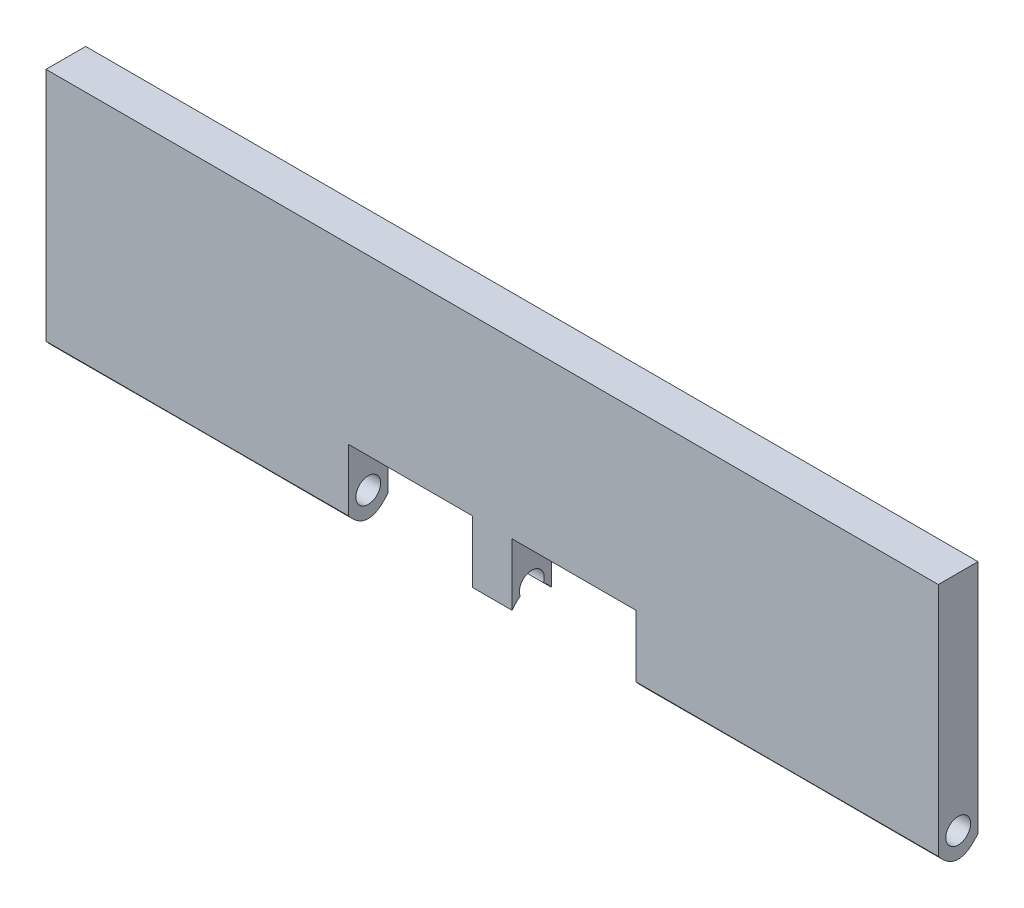
from build123d import *

# Parameters (mm, degrees)
BOSS_EXTRU_1_DEPTH      = 8
ENL_V_MAT_EXTRU_1_REACH = 183.904
ESQUISSE2_R             = 2.5
BOSS_EXTRU_2_DEPTH      = 2.5
BOSS_EXTRU_2_DEPTH_BACK = 2.5
ESQUISSE4_R             = 2.5
ENL_V_MAT_EXTRU_2_DEPTH = 8


with BuildPart() as part:
    # Esquisse1 → Boss.-Extru.1 (new body)
    with BuildSketch(Plane.XY):
        Polygon((-29, -25), (-29, -10), (-4, -10), (-4, -25), (4, -25), (4, -10), (29, -10), (29, -25), (90, -25), (90, 25), (-90, 25), (-90, -25), align=None)
    extrude(amount=BOSS_EXTRU_1_DEPTH)

    # Enlèv. mat.-Extru.1: up to this face of the body (flat: up to its plane)
    enl_v_mat_extru_1_end = Plane(part.part.faces().sort_by_distance((90, 0, 4))[0])
    # Esquisse2 → Enlèv. mat.-Extru.1 (cut, up to the picked face)
    with BuildSketch(Plane.ZY.offset(90), mode=Mode.PRIVATE) as enl_v_mat_extru_1_sk1:
        with BuildLine():
            add(Edge.make_bspline(
                [(4, -25), (6, -25), (8, -22.5)],
                knots=[0.5, 0.5, 0.5, 1, 1, 1], degree=2))
            Line((4, -25), (8, -25))
            Line((8, -25), (8, -22.5))
        make_face()
    enl_v_mat_extru_1_tool1 = split(extrude(enl_v_mat_extru_1_sk1.sketch, amount=-ENL_V_MAT_EXTRU_1_REACH, mode=Mode.PRIVATE), bisect_by=enl_v_mat_extru_1_end, keep=Keep.BOTH, mode=Mode.PRIVATE)
    # Esquisse2 → Enlèv. mat.-Extru.1 (cut, up to the picked face)
    with BuildSketch(Plane.ZY.offset(90), mode=Mode.PRIVATE) as enl_v_mat_extru_1_sk2:
        with BuildLine():
            add(Edge.make_bspline(
                [(0, -22.5), (2, -25), (4, -25)],
                knots=[0, 0, 0, 0.5, 0.5, 0.5], degree=2))
            Line((0, -22.5), (0, -25))
            Line((0, -25), (4, -25))
        make_face()
    enl_v_mat_extru_1_tool2 = split(extrude(enl_v_mat_extru_1_sk2.sketch, amount=-ENL_V_MAT_EXTRU_1_REACH, mode=Mode.PRIVATE), bisect_by=enl_v_mat_extru_1_end, keep=Keep.BOTH, mode=Mode.PRIVATE)
    # Esquisse2 → Enlèv. mat.-Extru.1 (cut, up to the picked face)
    with BuildSketch(Plane.ZY.offset(90), mode=Mode.PRIVATE) as enl_v_mat_extru_1_sk3:
        with Locations((4, -20)):
            Circle(ESQUISSE2_R)
    enl_v_mat_extru_1_tool3 = split(extrude(enl_v_mat_extru_1_sk3.sketch, amount=-ENL_V_MAT_EXTRU_1_REACH, mode=Mode.PRIVATE), bisect_by=enl_v_mat_extru_1_end, keep=Keep.BOTH, mode=Mode.PRIVATE)
    add(enl_v_mat_extru_1_tool1.solids().sort_by(Axis((-90, -24.25, 7), (1, 0, 0)))[0], mode=Mode.SUBTRACT)
    add(enl_v_mat_extru_1_tool2.solids().sort_by(Axis((-90, -24.25, 1), (1, 0, 0)))[0], mode=Mode.SUBTRACT)
    add(enl_v_mat_extru_1_tool3.solids().sort_by(Axis((-90, -20, 4), (1, 0, 0)))[0], mode=Mode.SUBTRACT)

    # Esquisse4 → Boss.-Extru.2 (add, two sides: drawn at the far end of the back side and taken through both)
    with BuildSketch(Plane(origin=(0, 0, 0), x_dir=(0, 0, -1), z_dir=(1, 0, 0)).offset(-BOSS_EXTRU_2_DEPTH_BACK)):
        with BuildLine():
            Line((5, 4.5), (0, 4.5))
            Line((0, 4.5), (0, -4.5))
            Line((0, -4.5), (5, -4.5))
            ThreePointArc((5, -4.5), (9.5, 0), (5, 4.5))
        make_face()
        with Locations((5, 0)):
            Circle(ESQUISSE4_R, mode=Mode.SUBTRACT)
    extrude(amount=BOSS_EXTRU_2_DEPTH + BOSS_EXTRU_2_DEPTH_BACK)

    # Esquisse6 → Enlèv. mat.-Extru.2 (cut)
    with BuildSketch(Plane.ZY.offset(4)):
        with BuildLine():
            add(Edge.make_bspline(
                [(0, -22.5), (4, -17.5), (8, -22.5)],
                knots=[0, 0, 0, 1, 1, 1], degree=2))
            add(Edge.make_bspline(
                [(0, -22.5), (4, -27.5), (8, -22.5)],
                knots=[0, 0, 0, 1, 1, 1], degree=2))
        make_face()
    extrude(amount=-ENL_V_MAT_EXTRU_2_DEPTH, mode=Mode.SUBTRACT)


solid = part.part
